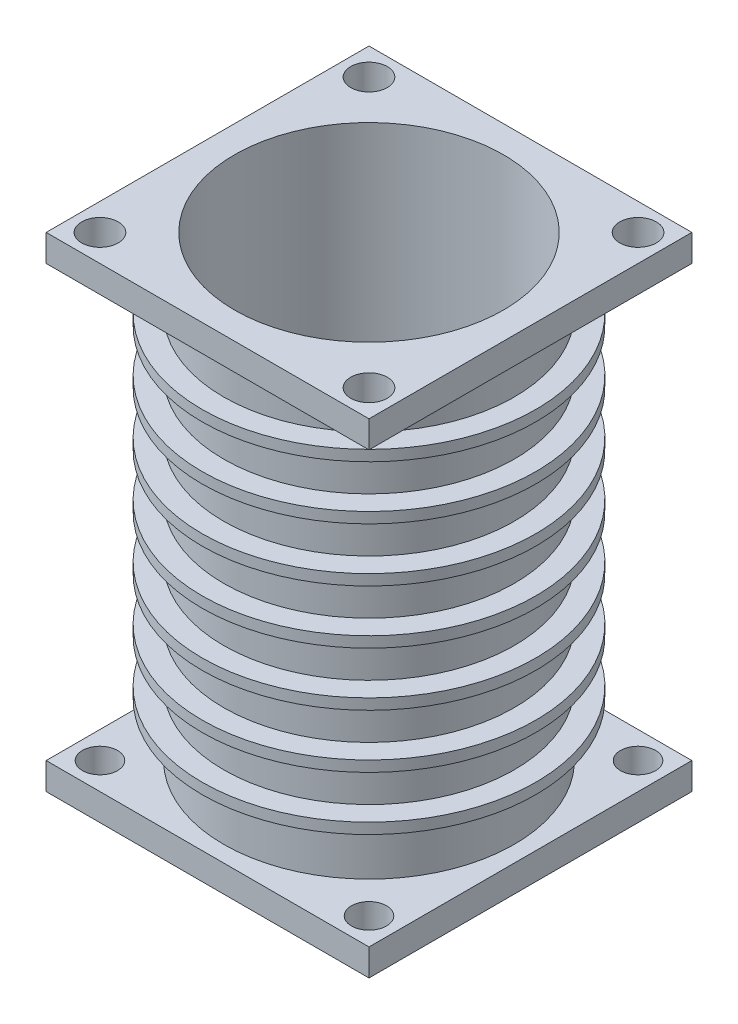
from build123d import *

# Parameters (mm, degrees)
SKETCH1_W               = 30
SKETCH1_H               = 30
SKETCH1_R               = 1.63
BOSS_EXTRUDE1_DEPTH     = 2.5
SKETCH2_R               = 12.5
CUT_EXTRUDE1_DEPTH      = 22.360009363
BOSS_EXTRUDE2_START     = 40
SKETCH3_R               = 13.5
SKETCH3_R_2             = 12.5
BOSS_EXTRUDE2_DEPTH     = 40
BOSS_EXTRUDE3_START     = -5
SKETCH4_R               = 15.5
BOSS_EXTRUDE3_DEPTH     = 1
LPATTERN1_COUNT         = 7
LPATTERN1_PITCH         = 5
CUT_EXTRUDE2_DEPTH      = 11
CUT_EXTRUDE2_DEPTH_BACK = 45.30293444
SKETCH5_R               = 12.5
SCALE1_SCALE            = 4
SKETCH8_W               = 120
SKETCH8_H               = 120
BOSS_EXTRUDE5_DEPTH     = 10
SKETCH9_R               = 6.8
CUT_EXTRUDE3_DEPTH      = 10
CUT_EXTRUDE4_REACH      = 202.22
SKETCH10_R              = 50


with BuildPart() as part:
    # Sketch1 → Boss-Extrude1 (new body)
    with BuildSketch(Plane(origin=(0, 0, 0), x_dir=(1, 0, 0), z_dir=(0, 1, 0))):
        Rectangle(SKETCH1_W, SKETCH1_H)
        with Locations(Location((-12.5, 12.5, 0), (0, 0, 270))):
            Circle(SKETCH1_R, mode=Mode.SUBTRACT)
        with Locations(Location((12.5, 12.5, 0), (0, 0, 270))):
            Circle(SKETCH1_R, mode=Mode.SUBTRACT)
        with Locations(Location((12.5, -12.5, 0), (0, 0, 270))):
            Circle(SKETCH1_R, mode=Mode.SUBTRACT)
        with Locations(Location((-12.5, -12.5, 0), (0, 0, 270))):
            Circle(SKETCH1_R, mode=Mode.SUBTRACT)
    extrude(amount=BOSS_EXTRUDE1_DEPTH)

    # Sketch2 → Cut-Extrude1 (cut, through all)
    with BuildSketch(Plane(origin=(0, 2.5, 0), x_dir=(1, 0, 0), z_dir=(0, 1, 0))):
        with Locations(Location((0, 0, 0), (0, 0, 270))):
            Circle(SKETCH2_R)
    extrude(amount=-CUT_EXTRUDE1_DEPTH, mode=Mode.SUBTRACT)

    # Sketch3 → Boss-Extrude2 (add)
    with BuildSketch(Plane(origin=(0, 2.5, 0), x_dir=(1, 0, 0), z_dir=(0, 1, 0)).offset(BOSS_EXTRUDE2_START)):
        with Locations(Location((0, 0, 0), (0, 0, 270))):
            Circle(SKETCH3_R)
        with Locations(Location((0, 0, 0), (0, 0, 270))):
            Circle(SKETCH3_R_2, mode=Mode.SUBTRACT)
    extrude(amount=-BOSS_EXTRUDE2_DEPTH)

    # Sketch4 → Boss-Extrude3 (add)
    with BuildSketch(Plane(origin=(0, 42.5, 0), x_dir=(1, 0, 0), z_dir=(0, 1, 0)).offset(BOSS_EXTRUDE3_START)):
        with Locations(Location((0, 0, 0), (0, 0, 270))):
            Circle(SKETCH4_R)
    boss_extrude3 = extrude(amount=BOSS_EXTRUDE3_DEPTH)

    # LPattern1: Boss-Extrude3 ×7
    with Locations(*[(0, -i * LPATTERN1_PITCH, 0) for i in range(1, LPATTERN1_COUNT)]):
        add(boss_extrude3)

    # Sketch5 → Cut-Extrude2 (cut, two sides: drawn at the far end of the back side and taken through both)
    with BuildSketch(Plane(origin=(0, 38.5, 0), x_dir=(1, 0, 0), z_dir=(0, 1, 0)).offset(-CUT_EXTRUDE2_DEPTH_BACK)):
        with Locations(Location((0, 0, 0), (0, 0, 270))):
            Circle(SKETCH5_R)
    extrude(amount=CUT_EXTRUDE2_DEPTH + CUT_EXTRUDE2_DEPTH_BACK, mode=Mode.SUBTRACT)


with BuildPart() as part_1:
    # Scale1: scaled about (0, 18.975181949, 0)
    add(part.part.scale(SCALE1_SCALE).moved(Location((0, -56.925545847, 0))))

    # Sketch8 → Boss-Extrude5 (add)
    with BuildSketch(Plane(origin=(0, 113.074454153, 0), x_dir=(1, 0, 0), z_dir=(0, 1, 0))):
        Rectangle(SKETCH8_W, SKETCH8_H)
    extrude(amount=BOSS_EXTRUDE5_DEPTH)

    # Sketch9 → Cut-Extrude3 (cut)
    with BuildSketch(Plane(origin=(0, 123.074454153, 0), x_dir=(1, 0, 0), z_dir=(0, 1, 0))):
        with Locations(Location((50, -50, 0), (0, 0, 270))):
            Circle(SKETCH9_R)
        with Locations(Location((-50, -50, 0), (0, 0, 90))):
            Circle(SKETCH9_R)
        with Locations(Location((-50, 50, 0), (0, 0, 270))):
            Circle(SKETCH9_R)
        with Locations(Location((50, 50, 0), (0, 0, 90))):
            Circle(SKETCH9_R)
    extrude(amount=-CUT_EXTRUDE3_DEPTH, mode=Mode.SUBTRACT)

    # Sketch10 → Cut-Extrude4 (cut, up to next)
    with BuildSketch(Plane.XZ.offset(56.925545847), mode=Mode.PRIVATE) as cut_extrude4_sk1:
        with Locations(Location((0, 0, 0), (0, 0, 90))):
            Circle(SKETCH10_R)
    cut_extrude4_tool1 = extrude(cut_extrude4_sk1.sketch, amount=-CUT_EXTRUDE4_REACH, mode=Mode.PRIVATE) & part_1.part
    add(cut_extrude4_tool1.solids().sort_by_distance((0, -56.925546, 0))[0], mode=Mode.SUBTRACT)


solid = part_1.part
